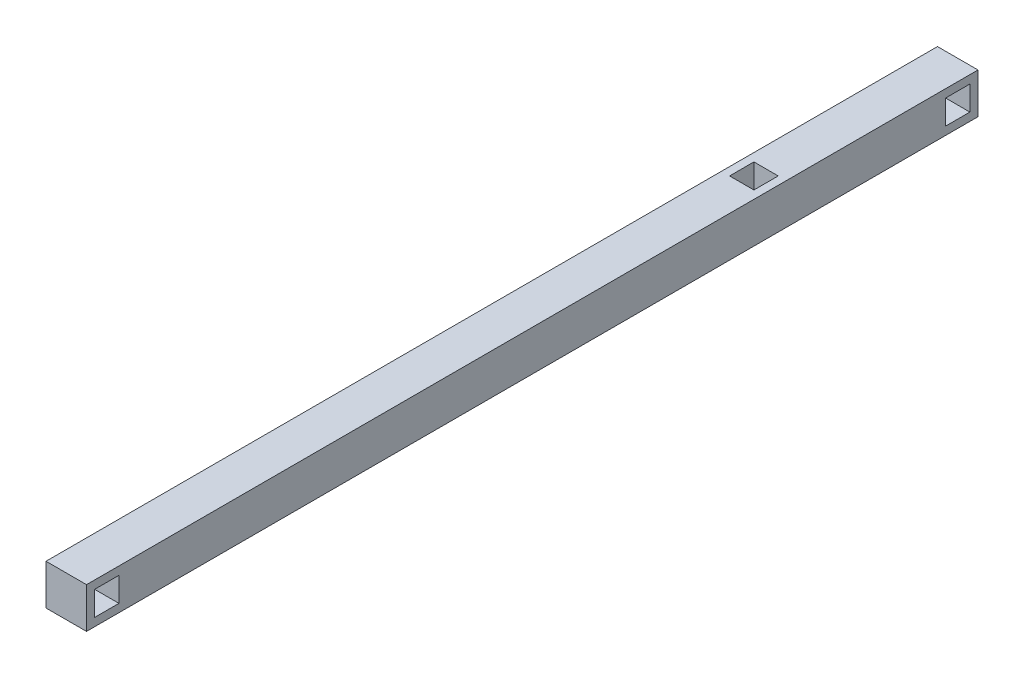
from build123d import *

# Parameters (mm, degrees)
SKETCH1_W           = 5
SKETCH1_H           = 5
BOSS_EXTRUDE1_DEPTH = 110
SKETCH2_W           = 3
SKETCH2_H           = 3
CUT_EXTRUDE1_DEPTH  = 9
SKETCH3_W           = 3
SKETCH3_H           = 3
CUT_EXTRUDE2_DEPTH  = 9


with BuildPart() as part:
    # Sketch1 → Boss-Extrude1 (new body)
    with BuildSketch(Plane.XY):
        with Locations((2.5, 2.5)):
            Rectangle(SKETCH1_W, SKETCH1_H)
    extrude(amount=BOSS_EXTRUDE1_DEPTH)

    # Sketch2 → Cut-Extrude1 (cut)
    with BuildSketch(Plane.ZY):
        with Locations((2.5, 2.5)):
            Rectangle(SKETCH2_W, SKETCH2_H)
        with Locations((107.5, 2.5)):
            Rectangle(SKETCH2_W, SKETCH2_H)
    extrude(amount=-CUT_EXTRUDE1_DEPTH, mode=Mode.SUBTRACT)

    # Sketch3 → Cut-Extrude2 (cut)
    with BuildSketch(Plane(origin=(0, 5, 0), x_dir=(1, 0, 0), z_dir=(0, 1, 0))):
        with Locations((2.5, -25.15)):
            Rectangle(SKETCH3_W, SKETCH3_H)
    extrude(amount=-CUT_EXTRUDE2_DEPTH, mode=Mode.SUBTRACT)


solid = part.part
